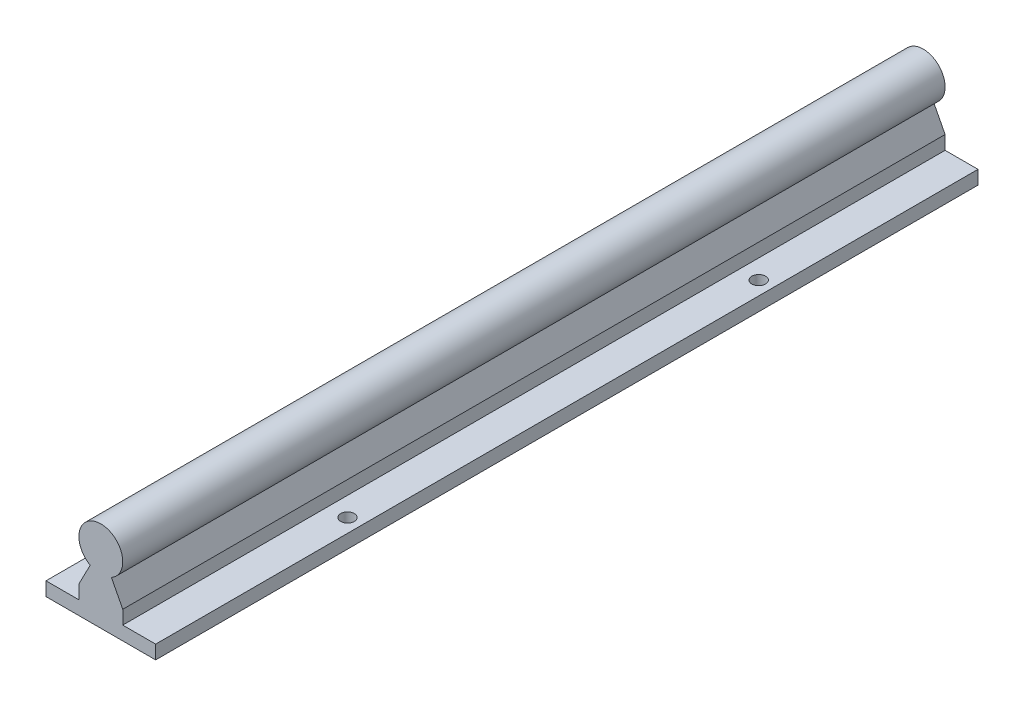
from build123d import *

# Parameters (mm, degrees)
BOSS_EXTRUDE3_DEPTH   = 300
BOSS_EXTRUDE4_DEPTH   = 300
F_5_0MM_DOWEL_HOLE1_D = 5
LPATTERN1_COUNT       = 2
LPATTERN1_PITCH       = 150


with BuildPart() as part:
    # Sketch2 → Boss-Extrude3 (new body)
    with BuildSketch(Plane.XY):
        with BuildLine():
            Line((-20, 5), (-20, 0))
            Line((-20, 0), (20, 0))
            Line((20, 0), (20, 5))
            Line((20, 5), (8, 5))
            Line((8, 5), (8, 10))
            Line((8, 10), (3.872983346, 18))
            ThreePointArc((3.872983346, 18), (0, 17), (-3.872983346, 18))
            Line((-3.872983346, 18), (-8, 10))
            Line((-8, 10), (-8, 5))
            Line((-8, 5), (-20, 5))
        make_face()
    extrude(amount=BOSS_EXTRUDE3_DEPTH)

    # Sketch2<4> → Boss-Extrude4 (add)
    with BuildSketch(Plane.XY):
        with BuildLine():
            ThreePointArc((8, 25), (-4.063012013, 31.891439137), (-3.872983346, 18))
            ThreePointArc((-3.872983346, 18), (0, 17), (3.872983346, 18))
            ThreePointArc((3.872983346, 18), (6.891439137, 20.936987987), (8, 25))
        make_face()
    extrude(amount=BOSS_EXTRUDE4_DEPTH)

    # Ø5.0mm Dowel Hole1 (through all)
    with Locations(Plane(origin=(0, 5, 0), x_dir=(1, 0, 0), z_dir=(0, 1, 0))):
        with Locations((-15, -225), (15, -225)):
            f_5_0mm_dowel_hole1 = Hole(F_5_0MM_DOWEL_HOLE1_D / 2)

    # LPattern1: Ø5.0mm Dowel Hole1 ×2
    with Locations(*[(0, 0, -i * LPATTERN1_PITCH) for i in range(1, LPATTERN1_COUNT)]):
        add(f_5_0mm_dowel_hole1, mode=Mode.SUBTRACT)


solid = part.part
